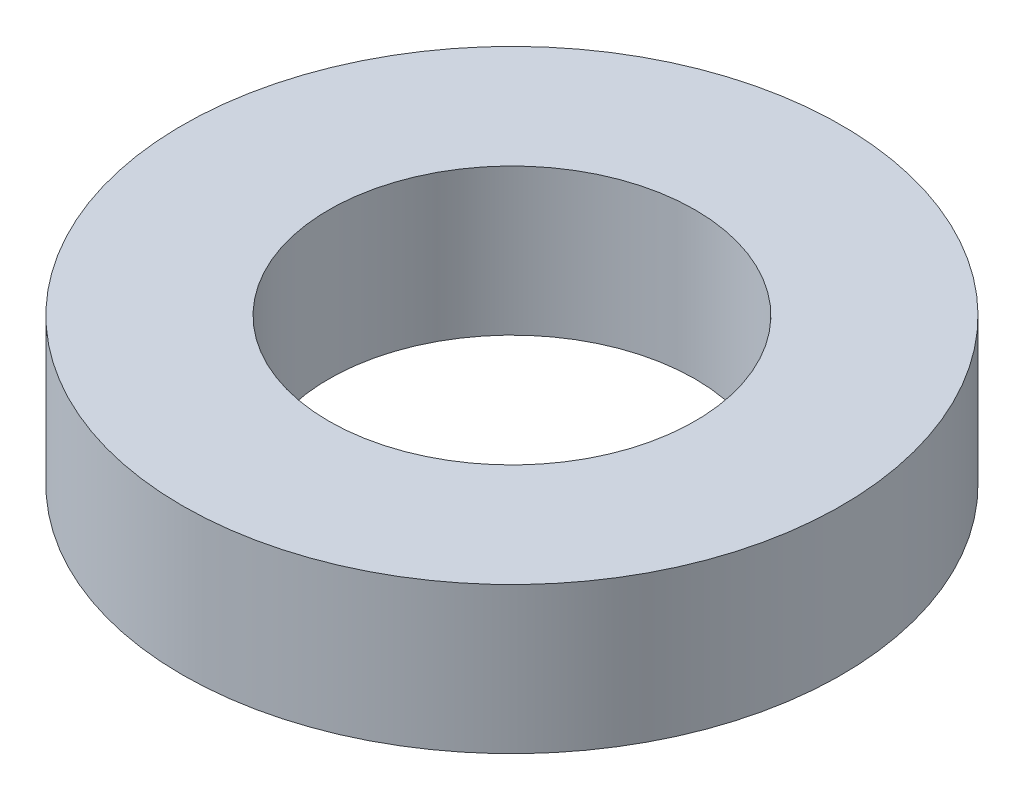
from build123d import *

# Parameters (mm, degrees)
SKETCH1_R           = 28.575
SKETCH1_R_2         = 15.875
BOSS_EXTRUDE1_DEPTH = 12.7


with BuildPart() as part:
    # Sketch1 → Boss-Extrude1 (new body)
    with BuildSketch(Plane(origin=(0, 0, 0), x_dir=(1, 0, 0), z_dir=(0, 1, 0))):
        with Locations(Location((0, 0, 0), (0, 0, 270))):
            Circle(SKETCH1_R)
        with Locations(Location((0, 0, 0), (0, 0, 270))):
            Circle(SKETCH1_R_2, mode=Mode.SUBTRACT)
    extrude(amount=BOSS_EXTRUDE1_DEPTH)


solid = part.part
